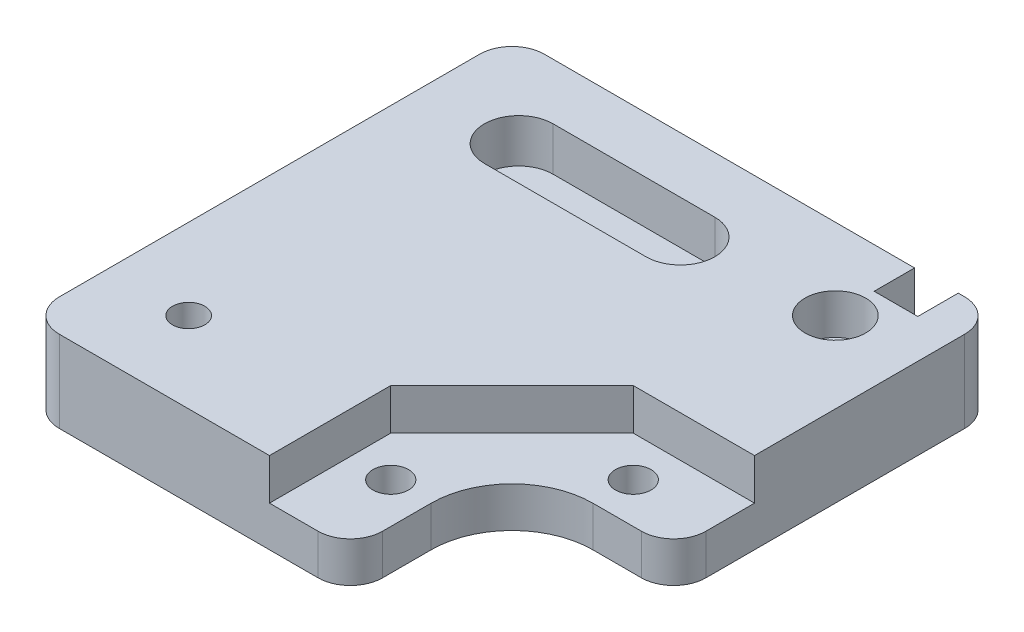
from build123d import *

# Parameters (mm, degrees)
SKETCH1_R           = 2.2
BOSS_EXTRUDE1_DEPTH = 10.1
CUT_EXTRUDE2_DEPTH  = 5.4
CUT_EXTRUDE4_DEPTH  = 5.1
SKETCH9_R           = 2
CUT_EXTRUDE5_DEPTH  = 73.814902321
SKETCH10_R          = 3.75
CUT_EXTRUDE6_DEPTH  = 5
FILLET2_R           = 10
FILLET3_R           = 4
CUT_EXTRUDE7_DEPTH  = 5


with BuildPart() as part:
    # Sketch1 → Boss-Extrude1 (new body)
    with BuildSketch(Plane(origin=(0, 0, 0), x_dir=(1, 0, 0), z_dir=(0, 1, 0))):
        Polygon((0, 0), (0, 20), (20, 20), (20, 60), (-40, 60), (-40, 0), align=None)
        with Locations(Location((10, 25, 0), (0, 0, 270))):
            Circle(SKETCH1_R, mode=Mode.SUBTRACT)
        with Locations(Location((-5, 10, 0), (0, 0, 90))):
            Circle(SKETCH1_R, mode=Mode.SUBTRACT)
    extrude(amount=BOSS_EXTRUDE1_DEPTH)

    # Sketch4 → Cut-Extrude2 (cut)
    with BuildSketch(Plane(origin=(0, 10.1, 0), x_dir=(1, 0, 0), z_dir=(0, 1, 0))):
        with BuildLine():
            Line((-28, 53.083248844), (-8, 53.083248844))
            ThreePointArc((-8, 53.083248844), (-3.75, 48.833248844), (-8, 44.583248844))
            Line((-8, 44.583248844), (-28, 44.583248844))
            ThreePointArc((-28, 44.583248844), (-32.25, 48.833248844), (-28, 53.083248844))
        make_face()
    extrude(amount=-CUT_EXTRUDE2_DEPTH, mode=Mode.SUBTRACT)

    # Sketch7 → Cut-Extrude4 (cut)
    with BuildSketch(Plane(origin=(0, 10.1, 0), x_dir=(1, 0, 0), z_dir=(0, 1, 0))):
        Polygon((20, 0), (-10, 0), (-10, 15), (5, 30), (20, 30), align=None)
    extrude(amount=-CUT_EXTRUDE4_DEPTH, mode=Mode.SUBTRACT)

    # Sketch9 → Cut-Extrude5 (cut, through all)
    with BuildSketch(Plane(origin=(0, 10.1, 0), x_dir=(1, 0, 0), z_dir=(0, 1, 0))):
        with Locations(Location((-30, 10, 0), (0, 0, 270))):
            Circle(SKETCH9_R)
        with Locations(Location((10, 50, 0), (0, 0, 90))):
            Circle(SKETCH9_R)
    extrude(amount=-CUT_EXTRUDE5_DEPTH, mode=Mode.SUBTRACT)

    # Sketch10 → Cut-Extrude6 (cut)
    with BuildSketch(Plane(origin=(0, 10.1, 0), x_dir=(1, 0, 0), z_dir=(0, 1, 0))):
        with Locations(Location((10, 50, 0), (0, 0, 270))):
            Circle(SKETCH10_R)
    extrude(amount=-CUT_EXTRUDE6_DEPTH, mode=Mode.SUBTRACT)

    # Fillet2
    fillet2_edges = [part.edges().sort_by_distance(p)[0] for p in [
        (0, 2.5, -20),
    ]]
    fillet(fillet2_edges, radius=FILLET2_R)

    # Fillet3
    fillet3_edges = [part.edges().sort_by_distance(p)[0] for p in [
        (-40, 5.05, -60),
        (20, 5.05, -60),
        (-40, 5.05, 0),
        (20, 2.5, -20),
        (0, 2.5, 0),
    ]]
    fillet(fillet3_edges, radius=FILLET3_R)

    # Sketch11 → Cut-Extrude7 (cut)
    with BuildSketch(Plane(origin=(0, 0, -60), x_dir=(-1, 0, 0), z_dir=(0, 0, -1))):
        Polygon((-16, 5), (-15.2, 5), (-15.2, 10.1), (-9.8, 10.1), (-9.8, 5), (-9, 5), (-9, 1.8), (-16, 1.8), align=None)
    extrude(amount=-CUT_EXTRUDE7_DEPTH, mode=Mode.SUBTRACT)


solid = part.part
